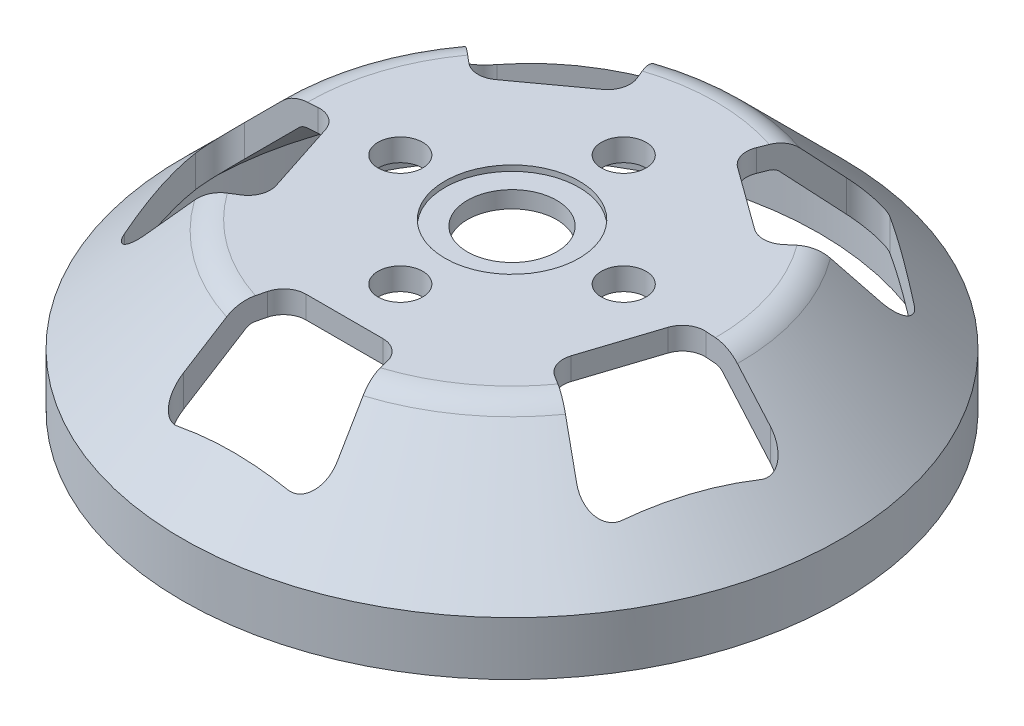
from build123d import *

# Parameters (mm, degrees)
SKETCH1_R           = 29.5
BOSS_EXTRUDE1_DEPTH = 4.8
SKETCH2_R           = 29.5
SKETCH3_R           = 19.5
FILLET1_R           = 3
SHELL1_T            = -2
CUT_EXTRUDE2_DEPTH  = 10
SKETCH5_R           = 4
CUT_EXTRUDE3_DEPTH  = 10
SKETCH5_3_R         = 6
SKETCH5_3_R_2       = 4
CUT_EXTRUDE4_DEPTH  = 0.5
SKETCH6_R           = 2
CUT_EXTRUDE5_DEPTH  = 10.5


with BuildPart() as part:
    # Sketch1 → Boss-Extrude1 (new body)
    with BuildSketch(Plane(origin=(0, 0, 0), x_dir=(1, 0, 0), z_dir=(0, 1, 0))):
        with Locations(Location((0, 0, 0), (0, 0, 270))):
            Circle(SKETCH1_R)
    extrude(amount=BOSS_EXTRUDE1_DEPTH)

    # Sketch2 → Loft1 section 0
    with BuildSketch(Plane(origin=(0, 4.8, 0), x_dir=(1, 0, 0), z_dir=(0, 1, 0))):
        Circle(SKETCH2_R)
    # Sketch3 → Loft1 section 1
    with BuildSketch(Plane(origin=(0, 14.8, 0), x_dir=(1, 0, 0), z_dir=(0, 1, 0))):
        Circle(SKETCH3_R)
    loft()

    # Fillet1
    fillet1_edges = [part.edges().sort_by_distance(p)[0] for p in [
        (-19.5, 14.8, 0),
    ]]
    fillet(fillet1_edges, radius=FILLET1_R)

    # Shell1
    shell1_openings = [part.faces().sort_by_distance(p)[0] for p in [
        (0, 0, 0),
    ]]
    offset(amount=SHELL1_T, openings=shell1_openings)

    # Sketch4 → Cut-Extrude2 (cut)
    with BuildSketch(Plane(origin=(0, 14.8, 0), x_dir=(1, 0, 0), z_dir=(0, 1, 0))):
        with BuildLine():
            ThreePointArc((19.999275892, -0.170187571), (19.021130326, -6.180339887), (16.279787816, -11.617594789))
            Line((16.279787816, -11.617594789), (19.287324556, -13.499558682))
            ThreePointArc((19.287324556, -13.499558682), (21.031681601, -13.683734747), (22.250348801, -12.422167237))
            Line((22.250348801, -12.422167237), (23.776412907, -7.725424859))
            Line((23.776412907, -7.725424859), (25.302477014, -3.028682482))
            ThreePointArc((25.302477014, -3.028682482), (25.058085316, -1.291738319), (23.538614847, -0.41543254))
            Line((23.538614847, -0.41543254), (19.999275892, -0.170187571))
        make_face()
        with BuildLine():
            Line((14.04451095, -10.218871941), (16.279787816, -11.617594789))
            ThreePointArc((16.279787816, -11.617594789), (19.021130326, -6.180339887), (19.999275892, -0.170187571))
            Line((19.999275892, -0.170187571), (17.368750258, 0.012084652))
            ThreePointArc((17.368750258, 0.012084652), (16.111589219, -0.325409966), (15.32838636, -1.365097312))
            Line((15.32838636, -1.365097312), (13.203309129, -7.905412519))
            ThreePointArc((13.203309129, -7.905412519), (13.225820663, -9.206892341), (14.04451095, -10.218871941))
        make_face()
        with BuildLine():
            Line((14.05871731, 10.199318564), (16.079720327, 11.892964063))
            ThreePointArc((16.079720327, 11.892964063), (11.755705046, 16.180339887), (6.341974124, 18.967850806))
            Line((6.341974124, 18.967850806), (5.355745814, 16.522397475))
            ThreePointArc((5.355745814, 16.522397475), (5.288238144, 15.222474704), (6.035016576, 14.156323463))
            Line((6.035016576, 14.156323463), (11.598540993, 10.114186368))
            ThreePointArc((11.598540993, 10.114186368), (12.843278305, 9.733416727), (14.05871731, 10.199318564))
        make_face()
        with BuildLine():
            ThreePointArc((6.341974124, 18.967850806), (11.755705046, 16.180339887), (16.079720327, 11.892964063))
            Line((16.079720327, 11.892964063), (18.798954315, 14.171742652))
            ThreePointArc((18.798954315, 14.171742652), (19.513152133, 15.773811252), (18.689919008, 17.322678434))
            Line((18.689919008, 17.322678434), (14.694631307, 20.225424859))
            Line((14.694631307, 20.225424859), (10.699343607, 23.128171285))
            ThreePointArc((10.699343607, 23.128171285), (8.971890355, 23.432486233), (7.668931836, 22.25817732))
            Line((7.668931836, 22.25817732), (6.341974124, 18.967850806))
        make_face()
        with BuildLine():
            ThreePointArc((-6.341974124, 18.967850806), (-11.755705046, 16.180339887), (-16.079720327, 11.892964063))
            Line((-16.079720327, 11.892964063), (-14.05871731, 10.199318564))
            ThreePointArc((-14.05871731, 10.199318564), (-12.843278305, 9.733416727), (-11.598540993, 10.114186368))
            Line((-11.598540993, 10.114186368), (-6.035016576, 14.156323463))
            ThreePointArc((-6.035016576, 14.156323463), (-5.288238144, 15.222474704), (-5.355745814, 16.522397475))
            Line((-5.355745814, 16.522397475), (-6.341974124, 18.967850806))
        make_face()
        with BuildLine():
            Line((-18.798954315, 14.171742652), (-16.079720327, 11.892964063))
            ThreePointArc((-16.079720327, 11.892964063), (-11.755705046, 16.180339887), (-6.341974124, 18.967850806))
            Line((-6.341974124, 18.967850806), (-7.668931836, 22.25817732))
            ThreePointArc((-7.668931836, 22.25817732), (-8.971890355, 23.432486233), (-10.699343607, 23.128171285))
            Line((-10.699343607, 23.128171285), (-14.694631307, 20.225424859))
            Line((-14.694631307, 20.225424859), (-18.689919008, 17.322678434))
            ThreePointArc((-18.689919008, 17.322678434), (-19.513152133, 15.773811252), (-18.798954315, 14.171742652))
        make_face()
        with BuildLine():
            Line((-19.287324556, -13.499558682), (-16.279787816, -11.617594789))
            ThreePointArc((-16.279787816, -11.617594789), (-19.021130326, -6.180339887), (-19.999275892, -0.170187571))
            Line((-19.999275892, -0.170187571), (-23.538614847, -0.41543254))
            ThreePointArc((-23.538614847, -0.41543254), (-25.058085316, -1.291738319), (-25.302477014, -3.028682482))
            Line((-25.302477014, -3.028682482), (-23.776412907, -7.725424859))
            Line((-23.776412907, -7.725424859), (-22.250348801, -12.422167237))
            ThreePointArc((-22.250348801, -12.422167237), (-21.031681601, -13.683734747), (-19.287324556, -13.499558682))
        make_face()
        with BuildLine():
            ThreePointArc((-19.999275892, -0.170187571), (-19.021130326, -6.180339887), (-16.279787816, -11.617594789))
            Line((-16.279787816, -11.617594789), (-14.04451095, -10.218871941))
            ThreePointArc((-14.04451095, -10.218871941), (-13.225820663, -9.206892341), (-13.203309129, -7.905412519))
            Line((-13.203309129, -7.905412519), (-15.32838636, -1.365097312))
            ThreePointArc((-15.32838636, -1.365097312), (-16.111589219, -0.325409966), (-17.368750258, 0.012084652))
            Line((-17.368750258, 0.012084652), (-19.999275892, -0.170187571))
        make_face()
        with BuildLine():
            Line((0, -25), (0, -20))
            ThreePointArc((0, -20), (-3.044614081, -19.766899734), (-6.018258127, -19.07303251))
            Line((-6.018258127, -19.07303251), (-6.878732187, -22.51492875))
            ThreePointArc((-6.878732187, -22.51492875), (-6.514858063, -24.230824419), (-4.938447187, -25))
            Line((-4.938447187, -25), (0, -25))
        make_face()
        with BuildLine():
            ThreePointArc((6.018258127, -19.07303251), (3.044614081, -19.766899734), (0, -20))
            Line((0, -20), (0, -25))
            Line((0, -25), (4.938447187, -25))
            ThreePointArc((4.938447187, -25), (6.514858063, -24.230824419), (6.878732187, -22.51492875))
            Line((6.878732187, -22.51492875), (6.018258127, -19.07303251))
        make_face()
        with BuildLine():
            ThreePointArc((5.378732187, -16.51492875), (4.669271606, -15.423589124), (3.438447187, -15))
            Line((3.438447187, -15), (0, -15))
            Line((0, -15), (0, -20))
            ThreePointArc((0, -20), (3.044614081, -19.766899734), (6.018258127, -19.07303251))
            Line((6.018258127, -19.07303251), (5.378732187, -16.51492875))
        make_face()
        with BuildLine():
            Line((0, -20), (0, -15))
            Line((0, -15), (-3.438447187, -15))
            ThreePointArc((-3.438447187, -15), (-4.669271606, -15.423589124), (-5.378732187, -16.51492875))
            Line((-5.378732187, -16.51492875), (-6.018258127, -19.07303251))
            ThreePointArc((-6.018258127, -19.07303251), (-3.044614081, -19.766899734), (0, -20))
        make_face()
    extrude(amount=-CUT_EXTRUDE2_DEPTH, mode=Mode.SUBTRACT)

    # Sketch5 → Cut-Extrude3 (cut)
    with BuildSketch(Plane(origin=(0, 14.8, 0), x_dir=(1, 0, 0), z_dir=(0, 1, 0))):
        with Locations(Location((0, 0, 0), (0, 0, 270))):
            Circle(SKETCH5_R)
    extrude(amount=-CUT_EXTRUDE3_DEPTH, mode=Mode.SUBTRACT)

    # Sketch5<3> → Cut-Extrude4 (cut)
    with BuildSketch(Plane(origin=(0, 14.8, 0), x_dir=(1, 0, 0), z_dir=(0, 1, 0))):
        with Locations(Location((0, 0, 0), (0, 0, 270))):
            Circle(SKETCH5_3_R)
        with Locations(Location((0, 0, 0), (0, 0, 270))):
            Circle(SKETCH5_3_R_2, mode=Mode.SUBTRACT)
    extrude(amount=-CUT_EXTRUDE4_DEPTH, mode=Mode.SUBTRACT)

    # Sketch6 → Cut-Extrude5 (cut)
    with BuildSketch(Plane(origin=(0, 14.8, 0), x_dir=(1, 0, 0), z_dir=(0, 1, 0))):
        with Locations(Location((0, 10, 0), (0, 0, 270))):
            Circle(SKETCH6_R)
        with Locations(Location((10, 0, 0), (0, 0, 270))):
            Circle(SKETCH6_R)
        with Locations(Location((0, -10, 0), (0, 0, 270))):
            Circle(SKETCH6_R)
        with Locations(Location((-10, 0, 0), (0, 0, 270))):
            Circle(SKETCH6_R)
    extrude(amount=-CUT_EXTRUDE5_DEPTH, mode=Mode.SUBTRACT)


solid = part.part
